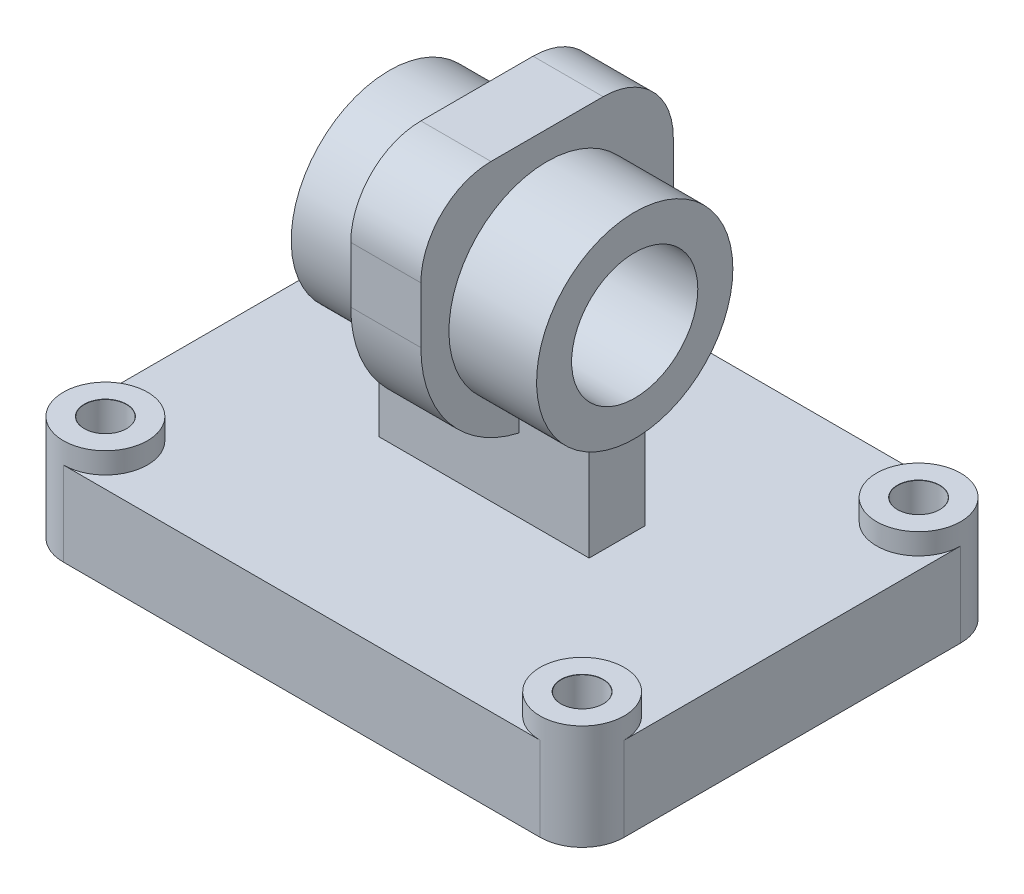
from build123d import *

# Parameters (mm, degrees)
BOSS_EXTRUDE1_DEPTH                = 12
SKETCH2_R                          = 6
BOSS_EXTRUDE2_DEPTH                = 3
F_6_0_6_DIAMETER_HOLE2_D           = 6
F_6_0_6_DIAMETER_HOLE2_CSINK_D     = 6.05
F_6_0_6_DIAMETER_HOLE2_CSINK_ANGLE = 90
SKETCH7_R                          = 14
SKETCH7_R_2                        = 9
BOSS_EXTRUDE4_DEPTH                = 17.5
BOSS_EXTRUDE6_DEPTH                = 5
SKETCH9_R                          = 9
CUT_EXTRUDE1_DEPTH                 = 30
BOSS_EXTRUDE7_REACH                = 69.941
SKETCH10_W                         = 30
SKETCH10_H                         = 8
FILLET1_R                          = 10


with BuildPart() as part:
    # Sketch1 → Boss-Extrude1 (new body)
    with BuildSketch(Plane(origin=(0, 0, 0), x_dir=(1, 0, 0), z_dir=(0, 1, 0))):
        with BuildLine():
            Line((-34, 30), (34, 30))
            ThreePointArc((34, 30), (38.242640687, 28.242640687), (40, 24))
            Line((40, 24), (40, -24))
            ThreePointArc((40, -24), (38.242640687, -28.242640687), (34, -30))
            Line((34, -30), (-34, -30))
            ThreePointArc((-34, -30), (-38.242640687, -28.242640687), (-40, -24))
            Line((-40, -24), (-40, 24))
            ThreePointArc((-40, 24), (-38.242640687, 28.242640687), (-34, 30))
        make_face()
    extrude(amount=BOSS_EXTRUDE1_DEPTH)

    # Sketch2 → Boss-Extrude2 (add)
    with BuildSketch(Plane(origin=(0, 12, 0), x_dir=(1, 0, 0), z_dir=(0, 1, 0))):
        with Locations(Location((-34, 24, 0), (0, 0, 90))):
            Circle(SKETCH2_R)
        with Locations(Location((-34, -24, 0), (0, 0, 270))):
            Circle(SKETCH2_R)
        with Locations(Location((34, 24, 0), (0, 0, 90))):
            Circle(SKETCH2_R)
        with Locations(Location((34, -24, 0), (0, 0, 270))):
            Circle(SKETCH2_R)
    extrude(amount=BOSS_EXTRUDE2_DEPTH)

    # Ø6.0 (6) Diameter Hole2 (through all)
    with Locations(Plane(origin=(0, 15, 0), x_dir=(1, 0, 0), z_dir=(0, 1, 0))):
        with Locations((-34, 24), (34, 24), (34, -24), (-34, -24)):
            CounterSinkHole(F_6_0_6_DIAMETER_HOLE2_D / 2, F_6_0_6_DIAMETER_HOLE2_CSINK_D / 2, counter_sink_angle=F_6_0_6_DIAMETER_HOLE2_CSINK_ANGLE)


with BuildPart() as body_2:
    # Sketch7 → Boss-Extrude4 (new, symmetric)
    with BuildSketch(Plane(origin=(0, 0, 0), x_dir=(0, 0, -1), z_dir=(1, 0, 0))):
        with Locations((0, 40)):
            Circle(SKETCH7_R)
        with Locations((0, 40)):
            Circle(SKETCH7_R_2, mode=Mode.SUBTRACT)
    extrude(amount=BOSS_EXTRUDE4_DEPTH, both=True)

    # Sketch8 → Boss-Extrude6 (add, symmetric)
    with BuildSketch(Plane(origin=(0, 0, 0), x_dir=(0, 0, -1), z_dir=(1, 0, 0))):
        with BuildLine():
            Line((-18, 40), (-18, 58))
            Line((-18, 58), (18, 58))
            Line((18, 58), (18, 40))
            ThreePointArc((18, 40), (0, 22), (-18, 40))
        make_face()
    extrude(amount=BOSS_EXTRUDE6_DEPTH, both=True)

    # Sketch9 → Cut-Extrude1 (cut, symmetric)
    with BuildSketch(Plane(origin=(5, 0, 0), x_dir=(0, 0, -1), z_dir=(1, 0, 0))):
        with Locations((0, 40)):
            Circle(SKETCH9_R)
    extrude(amount=CUT_EXTRUDE1_DEPTH, both=True, mode=Mode.SUBTRACT)

    # Sketch10 → Boss-Extrude7 (add, up to next)
    with BuildSketch(Plane(origin=(0, 12, 0), x_dir=(1, 0, 0), z_dir=(0, 1, 0)), mode=Mode.PRIVATE) as boss_extrude7_sk1:
        Rectangle(SKETCH10_W, SKETCH10_H)
    boss_extrude7_tool1 = extrude(boss_extrude7_sk1.sketch, amount=BOSS_EXTRUDE7_REACH, mode=Mode.PRIVATE) - body_2.part

    add(part.part)  # Boss-Extrude7 merges part
    add(boss_extrude7_tool1.solids().sort_by_distance((0, 12, 0))[0])

    # Fillet1
    fillet1_edges = [body_2.edges().sort_by_distance(p)[0] for p in [
        (0, 58, 18),
        (0, 58, -18),
    ]]
    fillet(fillet1_edges, radius=FILLET1_R)


solid = body_2.part
